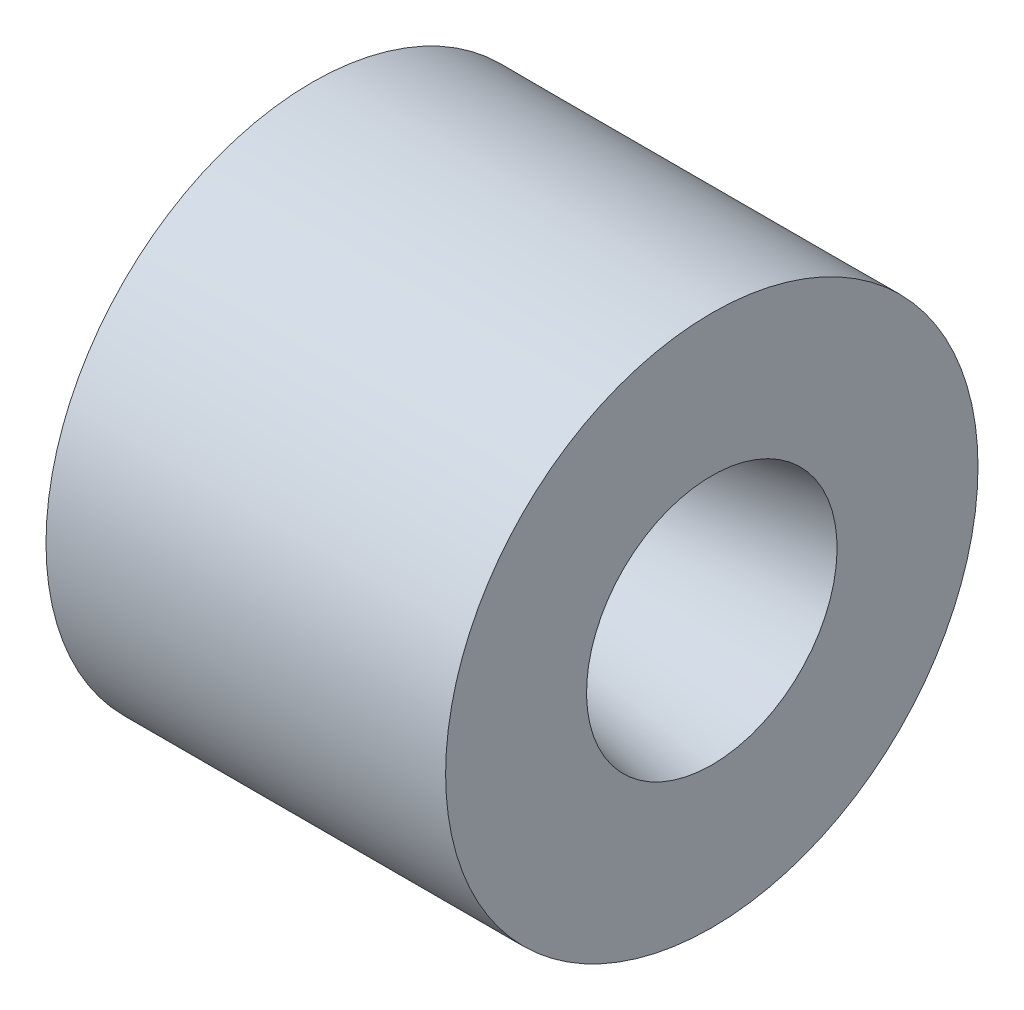
from build123d import *


with BuildPart() as part:
    # Sketch2 → Revolve1 (revolve)
    with BuildSketch(Plane.XY, mode=Mode.PRIVATE) as revolve1_sk:
        Polygon((-0.04338756, 16.999944633), (-0.04338756, 3.5), (25.477380628, 8), (25.477380628, 17), align=None)
    revolve(revolve1_sk.sketch.rotate(Axis((0.017017034, 0, 0), (1, 0, 0)), 180), axis=Axis((0.017017034, 0, 0), (1, 0, 0)))


solid = part.part
